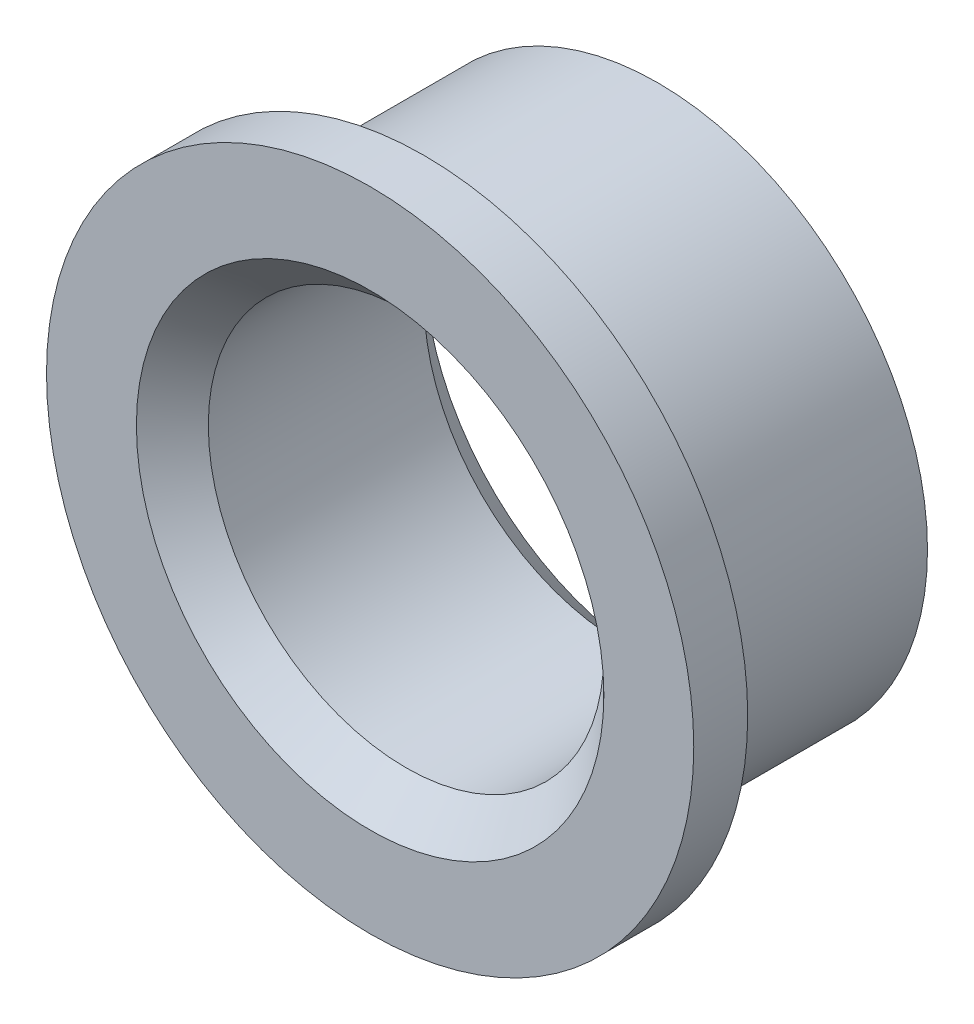
from build123d import *

# Parameters (mm, degrees)
CHAMFER1_SIZE = 1


with BuildPart() as part:
    # Sketch1 → Revolve1 (revolve)
    with BuildSketch(Plane(origin=(0, 0, 0), x_dir=(0, 0, -1), z_dir=(1, 0, 0)), mode=Mode.PRIVATE) as revolve1_sk:
        Polygon((8, 5.5), (0, 5.5), (0, 9), (1.5, 9), (1.5, 7.5), (8, 7.5), align=None)
    revolve(revolve1_sk.sketch.rotate(Axis((0, 0, 0), (0, 0, -1)), 90), axis=Axis((0, 0, 0), (0, 0, -1)))

    # Chamfer1
    chamfer1_edges = [part.edges().sort_by_distance(p)[0] for p in [
        (-5.5, 0, 0),
        (-5.5, 0, -8),
    ]]
    chamfer(chamfer1_edges, length=CHAMFER1_SIZE)


solid = part.part
